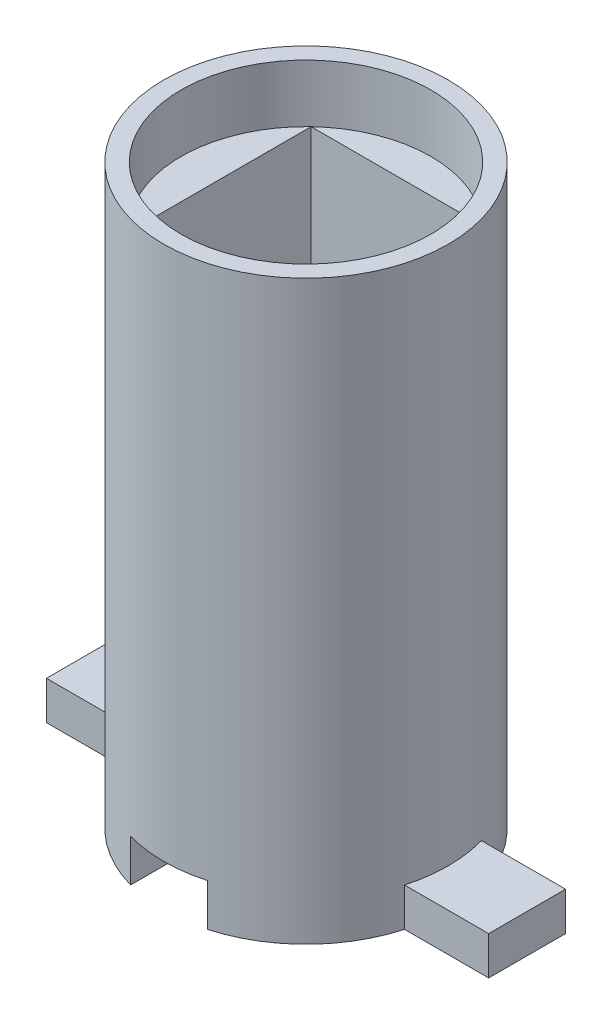
from build123d import *

# Parameters (mm, degrees)
SKETCH1_R           = 37
BOSS_EXTRUDE1_DEPTH = 150
SKETCH2_W           = 23
SKETCH2_H           = 23
CUT_EXTRUDE1_DEPTH  = 150
SKETCH3_W           = 43
SKETCH3_H           = 43
CUT_EXTRUDE2_DEPTH  = 36
CHAMFER1_SIZE       = 5
SKETCH5_R           = 32.5
CUT_EXTRUDE3_DEPTH  = 15
SKETCH11_W          = 44.607289856
SKETCH11_H          = 47.277792796
CUT_EXTRUDE7_DEPTH  = 104
SKETCH12_W          = 26
SKETCH12_H          = 20
BOSS_EXTRUDE2_DEPTH = 10
SKETCH13_W          = 20
SKETCH13_H          = 31
CUT_EXTRUDE8_DEPTH  = 11
SKETCH14_W          = 20
SKETCH14_H          = 10
BOSS_EXTRUDE3_DEPTH = 10
SKETCH15_W          = 20
SKETCH15_H          = 10
BOSS_EXTRUDE4_DEPTH = 10


with BuildPart() as part:
    # Sketch1 → Boss-Extrude1 (new body)
    with BuildSketch(Plane(origin=(0, 0, 0), x_dir=(1, 0, 0), z_dir=(0, 1, 0))):
        with Locations(Location((0, 0, 0), (0, 0, 270))):
            Circle(SKETCH1_R)
    extrude(amount=BOSS_EXTRUDE1_DEPTH)

    # Sketch2 → Cut-Extrude1 (cut)
    with BuildSketch(Plane(origin=(0, 150, 0), x_dir=(1, 0, 0), z_dir=(0, 1, 0))):
        Rectangle(SKETCH2_W, SKETCH2_H)
    extrude(amount=-CUT_EXTRUDE1_DEPTH, mode=Mode.SUBTRACT)

    # Sketch3 → Cut-Extrude2 (cut)
    with BuildSketch(Plane.XZ):
        Rectangle(SKETCH3_W, SKETCH3_H)
    extrude(amount=-CUT_EXTRUDE2_DEPTH, mode=Mode.SUBTRACT)

    # Chamfer1
    chamfer1_edges = [part.edges().sort_by_distance(p)[0] for p in [
        (21.5, 18, 21.5),
        (21.5, 18, -21.5),
        (-21.5, 18, -21.5),
        (-21.5, 18, 21.5),
    ]]
    chamfer(chamfer1_edges, length=CHAMFER1_SIZE)

    # Sketch5 → Cut-Extrude3 (cut)
    with BuildSketch(Plane(origin=(0, 150, 0), x_dir=(1, 0, 0), z_dir=(0, 1, 0))):
        with Locations(Location((0, 0, 0), (0, 0, 270))):
            Circle(SKETCH5_R)
    extrude(amount=-CUT_EXTRUDE3_DEPTH, mode=Mode.SUBTRACT)

    # Sketch11 → Cut-Extrude7 (cut)
    with BuildSketch(Plane(origin=(0, 135, 0), x_dir=(1, 0, 0), z_dir=(0, 1, 0))):
        Rectangle(SKETCH11_W, SKETCH11_H)
    extrude(amount=-CUT_EXTRUDE7_DEPTH, mode=Mode.SUBTRACT)

    # Sketch12 → Boss-Extrude2 (add)
    with BuildSketch(Plane.XZ):
        with Locations((-34.5, 0)):
            Rectangle(SKETCH12_W, SKETCH12_H)
        with Locations((34.5, 0)):
            Rectangle(SKETCH12_W, SKETCH12_H)
    extrude(amount=-BOSS_EXTRUDE2_DEPTH)

    # Sketch13 → Cut-Extrude8 (cut)
    with BuildSketch(Plane.XZ):
        with Locations((0, 37)):
            Rectangle(SKETCH13_W, SKETCH13_H)
    extrude(amount=-CUT_EXTRUDE8_DEPTH, mode=Mode.SUBTRACT)

    # Sketch14 → Boss-Extrude3 (add)
    with BuildSketch(Plane(origin=(47.5, 0, 0), x_dir=(0, 0, -1), z_dir=(1, 0, 0))):
        with Locations((0, 5)):
            Rectangle(SKETCH14_W, SKETCH14_H)
    extrude(amount=BOSS_EXTRUDE3_DEPTH)

    # Sketch15 → Boss-Extrude4 (add)
    with BuildSketch(Plane.ZY.offset(47.5)):
        with Locations((0, 5)):
            Rectangle(SKETCH15_W, SKETCH15_H)
    extrude(amount=BOSS_EXTRUDE4_DEPTH)


solid = part.part
